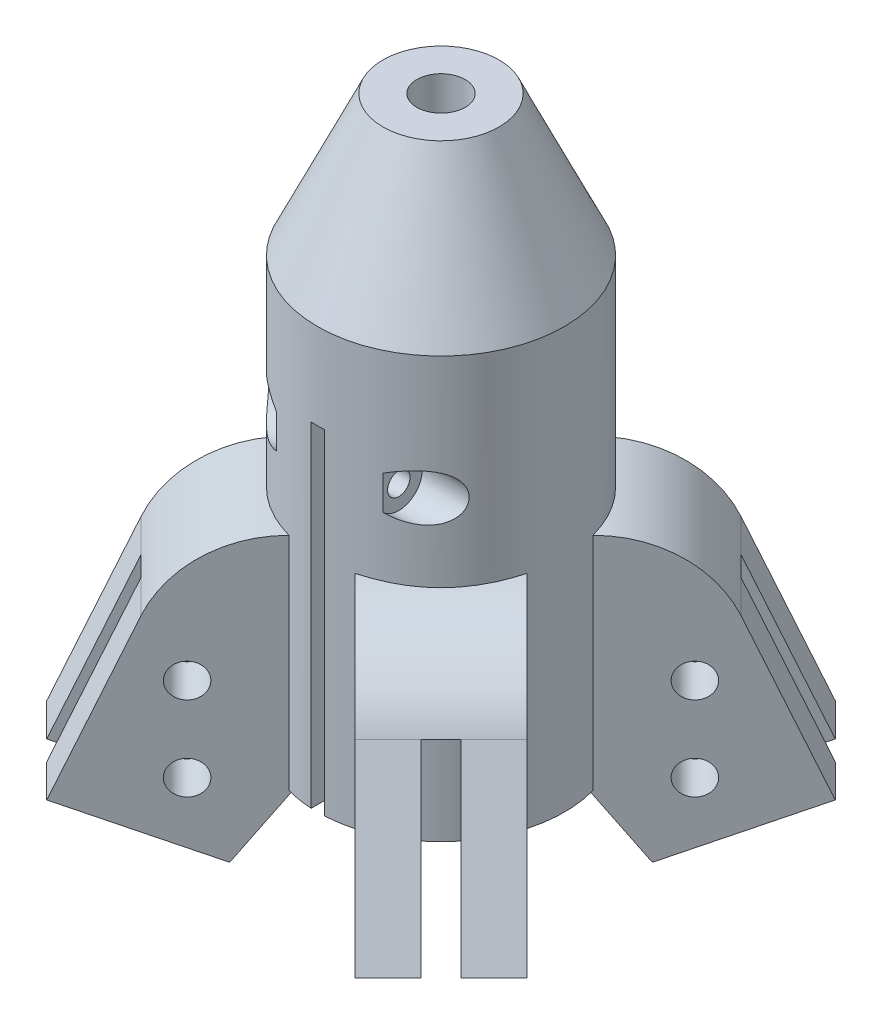
from build123d import *

# Parameters (mm, degrees)
SKETCH1_R                   = 13.21
SKETCH1_R_2                 = 2.585
BOSS_EXTRUDE1_DEPTH         = 20
CHAMFER1_SIZE               = 1.2
BOSS_EXTRUDE5_START         = 40
SKETCH7_R                   = 13.21
SKETCH7_R_2                 = 3.785
BOSS_EXTRUDE5_DEPTH         = 40
CUT_EXTRUDE3_DEPTH          = 0.7
CUT_EXTRUDE3_DEPTH_BACK     = 0.7
SKETCH8_W                   = 13.21
SKETCH8_H                   = 35.8
SKETCH11_W                  = 13.21
SKETCH11_H                  = 35.8
CUT_EXTRUDE5_DEPTH          = 2.5
CUT_EXTRUDE6_DEPTH          = 45.362058113
CUT_EXTRUDE6_DEPTH_BACK     = 45.362058113
SKETCH12_R                  = 1.2
SKETCH13_R                  = 2.5
CUT_EXTRUDE7_DEPTH          = 47.174584074
SKETCH15_R                  = 1.8
BOSS_EXTRUDE6_DEPTH         = 5
BOSS_EXTRUDE7_REACH         = 61.49
CIRPATTERN2_COUNT           = 4
CIRPATTERN2_COPY_1_SKETCH_R = 1.8
CIRPATTERN2_COPY_1_DEPTH    = 5
CIRPATTERN2_COPY_2_SKETCH_R = 1.8
CIRPATTERN2_COPY_2_DEPTH    = 5
CIRPATTERN2_COPY_3_SKETCH_R = 1.8
CIRPATTERN2_COPY_3_DEPTH    = 5
CHAMFER2_SIZE               = 15
CHAMFER2_SIZE2              = 6.994614872


with BuildPart() as part:
    # Sketch1 → Boss-Extrude1 (new body)
    with BuildSketch(Plane(origin=(0, 0, 0), x_dir=(1, 0, 0), z_dir=(0, 1, 0))):
        with Locations(Location((0, 0, 0), (0, 0, 270))):
            Circle(SKETCH1_R)
        with Locations(Location((0, 0, 0), (0, 0, 270))):
            Circle(SKETCH1_R_2, mode=Mode.SUBTRACT)
    extrude(amount=BOSS_EXTRUDE1_DEPTH)

    # Chamfer1
    chamfer1_edges = [part.edges().sort_by_distance(p)[0] for p in [
        (0, 0, -2.585),
    ]]
    chamfer(chamfer1_edges, length=CHAMFER1_SIZE)

    # Sketch7 → Boss-Extrude5 (add)
    with BuildSketch(Plane.XZ.offset(BOSS_EXTRUDE5_START)):
        with Locations(Location((0, 0, 0), (0, 0, 270))):
            Circle(SKETCH7_R)
        with Locations(Location((0, 0, 0), (0, 0, 270))):
            Circle(SKETCH7_R_2, mode=Mode.SUBTRACT)
    extrude(amount=-BOSS_EXTRUDE5_DEPTH)

    # Sketch8 → Cut-Extrude3 (cut, two sides: drawn at the far end of the back side and taken through both)
    with BuildSketch(Plane(origin=(0, 0, 0), x_dir=(0, 0, -1), z_dir=(1, 0, 0)).offset(-CUT_EXTRUDE3_DEPTH_BACK)):
        with Locations((-6.605, -22.1)):
            Rectangle(SKETCH8_W, SKETCH8_H)
    extrude(amount=CUT_EXTRUDE3_DEPTH + CUT_EXTRUDE3_DEPTH_BACK, mode=Mode.SUBTRACT)

    # Sketch11 → Cut-Extrude5 (cut, symmetric)
    with BuildSketch(Plane(origin=(0, 0, 0), x_dir=(0, 0, -1), z_dir=(1, 0, 0))):
        with Locations((6.605, -22.1)):
            Rectangle(SKETCH11_W, SKETCH11_H)
    extrude(amount=CUT_EXTRUDE5_DEPTH, both=True, mode=Mode.SUBTRACT)

    # Sketch12 → Cut-Extrude6 (cut, two sides: drawn at the far end of the back side and taken through both)
    with BuildSketch(Plane.ZY.offset(-0.7).offset(-CUT_EXTRUDE6_DEPTH_BACK)):
        with Locations((10.21, -8.2)):
            Circle(SKETCH12_R)
    extrude(amount=CUT_EXTRUDE6_DEPTH + CUT_EXTRUDE6_DEPTH_BACK, mode=Mode.SUBTRACT)

    # Sketch13 → Cut-Extrude7 (cut, through all)
    with BuildSketch(Plane.ZY.offset(-5.7)):
        with Locations((10.21, -8.2)):
            Circle(SKETCH13_R)
    cut_extrude7 = extrude(amount=-CUT_EXTRUDE7_DEPTH, mode=Mode.SUBTRACT)

    # Mirror2: Cut-Extrude7 across plane
    add(cut_extrude7.mirror(Plane(origin=(0, 0, 0), x_dir=(0, 0, 1), z_dir=(1, 0, 0))), mode=Mode.SUBTRACT)

    # Sketch15 → Boss-Extrude6 (add)
    with BuildSketch(Plane(origin=(-1.060660172, 0, -1.060660172), x_dir=(-0.7071067811865488, -3.372135297382167e-15, 0.7071067811865462), z_dir=(-0.7071067811865462, 3.3721352973821793e-15, -0.7071067811865488))):
        Polygon((-22.70423895, -23.81017386), (-11.21, -23.81017386), (-11.21, -35.211035784), (-11.21, -40), (-15.990174244, -46.657077484), (-29.831605047, -40.876524454), align=None)
        with Locations((-19.21, -29.81017386)):
            Circle(SKETCH15_R, mode=Mode.SUBTRACT)
        with Locations((-19.21, -38.81017386)):
            Circle(SKETCH15_R, mode=Mode.SUBTRACT)
    boss_extrude6 = extrude(amount=BOSS_EXTRUDE6_DEPTH)

    # Mirror3: Boss-Extrude6 across plane
    add(boss_extrude6.mirror(Plane(origin=(0, 0, 0), x_dir=(-0.7071067811865488, 3.3721352973821916e-15, 0.7071067811865464), z_dir=(0.7071067811865462, -3.3721352973821793e-15, 0.7071067811865488))))

    # Boss-Extrude7: up to this face of the body (flat: up to its plane)
    boss_extrude7_end = Plane(part.part.faces().sort_by_distance((18.066702505, -34.728946199, -8.87431435))[0])
    # Sketch16 → Boss-Extrude7 (add, up to the picked face)
    with BuildSketch(Plane(origin=(-4.596194078, 0, -4.596194078), x_dir=(-0.7071067811865486, -3.1363800445660566e-15, 0.7071067811865465), z_dir=(-0.7071067811865465, 3.1363800445660664e-15, -0.7071067811865486)), mode=Mode.PRIVATE) as boss_extrude7_sk1:
        with BuildLine():
            Line((-11.500178259, -23.81017386), (-22.70423895, -23.81017386))
            ThreePointArc((-22.70423895, -23.81017386), (-18.231146382, -18.383887076), (-11.500178259, -16.347416226))
            Line((-11.500178259, -16.347416226), (-11.500178259, -23.81017386))
        make_face()
    boss_extrude7_tool1 = split(extrude(boss_extrude7_sk1.sketch, amount=-BOSS_EXTRUDE7_REACH, mode=Mode.PRIVATE), bisect_by=boss_extrude7_end, keep=Keep.BOTH, mode=Mode.PRIVATE)
    boss_extrude7 = boss_extrude7_tool1.solids().sort_by(Axis((6.682248, -20.729124, -15.874636), (0.7071067811865465, -3.1363800445660664e-15, 0.7071067811865486)))[0]
    add(boss_extrude7)

    # CirPattern2: Boss-Extrude6, Boss-Extrude7 ×4 about axis
    cirpattern2_axis = Axis((0, 0, 0), (0, 1, 0))
    add([boss_extrude6.rotate(cirpattern2_axis, i * 360 / CIRPATTERN2_COUNT) for i in range(1, CIRPATTERN2_COUNT)])
    add([boss_extrude7.rotate(cirpattern2_axis, i * 360 / CIRPATTERN2_COUNT) for i in range(1, CIRPATTERN2_COUNT)])

    # CirPattern2 copy 1 sketch → CirPattern2 copy 1 (add)
    with BuildSketch(Plane(origin=(1.060660172, 0, -1.060660172), x_dir=(0.7071067811865462, -3.372135297382167e-15, 0.7071067811865489), z_dir=(0.7071067811865488, -3.3721352973821793e-15, -0.7071067811865461))):
        Polygon((-22.70423895, 23.81017386), (-11.21, 23.81017386), (-11.21, 35.211035784), (-11.21, 40), (-15.990174244, 46.657077484), (-29.831605047, 40.876524454), align=None)
        with Locations((-19.21, 29.81017386)):
            Circle(CIRPATTERN2_COPY_1_SKETCH_R, mode=Mode.SUBTRACT)
        with Locations((-19.21, 38.81017386)):
            Circle(CIRPATTERN2_COPY_1_SKETCH_R, mode=Mode.SUBTRACT)
    extrude(amount=CIRPATTERN2_COPY_1_DEPTH)

    # CirPattern2 copy 2 sketch → CirPattern2 copy 2 (add)
    with BuildSketch(Plane(origin=(-1.060660172, 0, -1.060660172), x_dir=(0.7071067811865489, -3.372135297382167e-15, -0.7071067811865462), z_dir=(-0.7071067811865461, -3.3721352973821793e-15, -0.7071067811865488))):
        Polygon((-22.70423895, 23.81017386), (-11.21, 23.81017386), (-11.21, 35.211035784), (-11.21, 40), (-15.990174244, 46.657077484), (-29.831605047, 40.876524454), align=None)
        with Locations((-19.21, 29.81017386)):
            Circle(CIRPATTERN2_COPY_2_SKETCH_R, mode=Mode.SUBTRACT)
        with Locations((-19.21, 38.81017386)):
            Circle(CIRPATTERN2_COPY_2_SKETCH_R, mode=Mode.SUBTRACT)
    extrude(amount=CIRPATTERN2_COPY_2_DEPTH)

    # CirPattern2 copy 3 sketch → CirPattern2 copy 3 (add)
    with BuildSketch(Plane(origin=(-1.060660172, 0, 1.060660172), x_dir=(-0.7071067811865461, -3.372135297382167e-15, -0.707106781186549), z_dir=(-0.7071067811865489, -3.3721352973821793e-15, 0.707106781186546))):
        Polygon((-22.70423895, 23.81017386), (-11.21, 23.81017386), (-11.21, 35.211035784), (-11.21, 40), (-15.990174244, 46.657077484), (-29.831605047, 40.876524454), align=None)
        with Locations((-19.21, 29.81017386)):
            Circle(CIRPATTERN2_COPY_3_SKETCH_R, mode=Mode.SUBTRACT)
        with Locations((-19.21, 38.81017386)):
            Circle(CIRPATTERN2_COPY_3_SKETCH_R, mode=Mode.SUBTRACT)
    extrude(amount=CIRPATTERN2_COPY_3_DEPTH)

    # Chamfer2
    chamfer2_edges = [part.edges().sort_by_distance(p)[0] for p in [
        (0, 20, -13.21),
    ]]
    chamfer2_side = [part.faces().sort_by_distance(p)[0] for p in [
        (0, 10, -13.21),
    ]]
    chamfer(chamfer2_edges, length=CHAMFER2_SIZE, length2=CHAMFER2_SIZE2, reference=chamfer2_side[0])


solid = part.part
